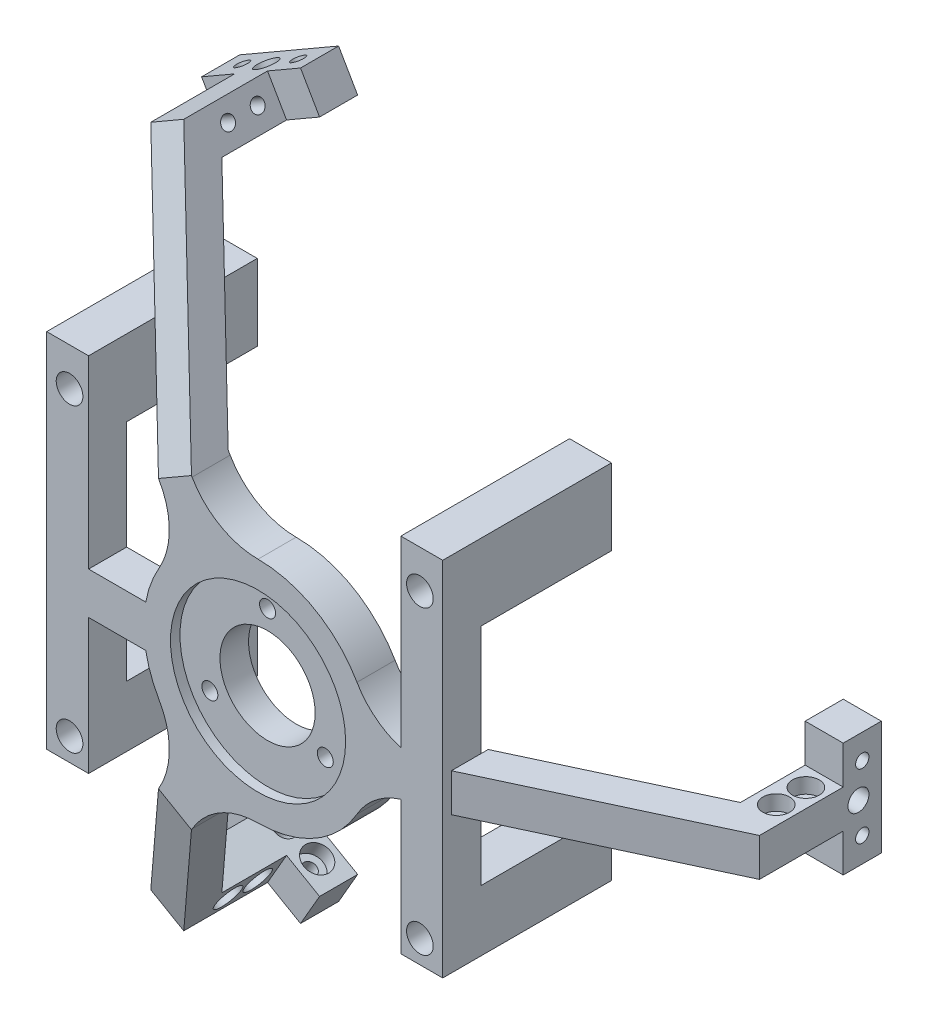
from build123d import *
from OCP.BRepFilletAPI import BRepFilletAPI_MakeChamfer

# Parameters (mm, degrees)
ESQUISSE1_W                    = 10
ESQUISSE1_H                    = 30.000000000000004
BOSS_EXTRU_1_DEPTH             = 10
BOSS_EXTRU_1_2_DEPTH           = 10
BOSS_EXTRU_1_3_DEPTH           = 10
ESQUISSE2_W                    = 10
ESQUISSE2_H                    = 9.999999999999995
BOSS_EXTRU_2_DEPTH             = 40
BOSS_EXTRU_3_DEPTH             = 10
CHANFREIN1_SIZE                = 23
CHANFREIN1_SIZE2               = 49.32365917172017
CHANFREIN2_SIZE                = 28
CHANFREIN2_SIZE2               = 60.04619377426803
CONG_1_R                       = 20
ENL_V_MAT_EXTRU_1_REACH        = 156.308
ESQUISSE4_R                    = 12.5
ESQUISSE5_R                    = 23
ENL_V_MAT_EXTRU_2_DEPTH        = 2.5
ENL_V_MAT_EXTRU_3_REACH        = 155.353
ESQUISSE6_R                    = 2.1000000000000005
ESQUISSE6_R_2                  = 2.100000000000001
BOSS_EXTRU_4_DEPTH             = 34.3
BOSS_EXTRU_4_DIRECTION_2_REACH = 152.702
ENL_V_MAT_EXTRU_4_REACH        = 150.908
ESQUISSE8_R                    = 1.7500000000000038
ESQUISSE9_R                    = 3.500000000000001
ENL_V_MAT_EXTRU_5_DEPTH        = 23.3
ENL_V_MAT_EXTRU_6_DEPTH        = 34.3
ENL_V_MAT_EXTRU_7_REACH        = 155.051
ESQUISSE11_R                   = 1.7500000000000004
ESQUISSE12_R                   = 3.5000000000000027
ESQUISSE12_R_2                 = 3.500000000000001
ENL_V_MAT_EXTRU_8_DEPTH        = 4
ENL_V_MAT_EXTRU_9_REACH        = 242.996
ESQUISSE13_R                   = 1.7499999999999998
ESQUISSE14_R                   = 3.5
ENL_V_MAT_EXTRU_10_DEPTH       = 4
ENL_V_MAT_EXTRU_11_REACH       = 242.996
ESQUISSE15_R                   = 2.75
R_P_TITION_CIRCULAIRE1_COUNT   = 3


with BuildPart() as part:
    # Esquisse1 → Boss.-Extru.1 (new body)
    with BuildSketch(Plane.XY):
        with Locations((98.67, 0)):
            Rectangle(ESQUISSE1_W, ESQUISSE1_H)
    extrude(amount=BOSS_EXTRU_1_DEPTH)



with BuildPart() as body_2:
    # Esquisse1 → Boss.-Extru.1 2 (new body)
    with BuildSketch(Plane.XY):
        Polygon((-33.84461894323341, -88.62059957248839), (-59.82538105676657, -73.6205995724884), (-64.82538105676656, -82.28085361033277), (-38.84461894323341, -97.28085361033276), align=None)
    extrude(amount=BOSS_EXTRU_1_2_DEPTH)


with BuildPart() as body_3:
    # Esquisse1 → Boss.-Extru.1 3 (new body)
    with BuildSketch(Plane.XY):
        Polygon((-59.825381056766616, 73.62059957248836), (-33.84461894323346, 88.62059957248837), (-38.84461894323348, 97.28085361033274), (-64.82538105676662, 82.28085361033273), align=None)
    extrude(amount=BOSS_EXTRU_1_3_DEPTH)


with BuildPart() as part_1:
    add(part.part)

    add(body_2.part)  # Boss.-Extru.2 merges body 2

    add(body_3.part)  # Boss.-Extru.2 merges body 3
    # Esquisse2 → Boss.-Extru.2 (add)
    with BuildSketch(Plane.XY.offset(10)):
        Polygon((-47.50487298107785, 92.28085361033274), (-56.16512701892224, 87.28085361033274), (-51.165127018922234, 78.62059957248836), (-42.50487298107785, 83.62059957248836), align=None)
        with Locations((98.67, 0)):
            Rectangle(ESQUISSE2_W, ESQUISSE2_H)
        Polygon((-42.504872981077796, -83.62059957248839), (-51.16512701892218, -78.62059957248839), (-56.16512701892218, -87.28085361033276), (-47.50487298107779, -92.28085361033277), align=None)
    extrude(amount=BOSS_EXTRU_2_DEPTH)

    # Esquisse3 → Boss.-Extru.3 (add)
    with BuildSketch(Plane.XY.offset(50)):
        with BuildLine():
            Line((103.67, 4.999999999999997), (103.67, -4.999999999999997))
            Line((103.67, -4.999999999999997), (29.58039891549808, -4.999999999999997))
            ThreePointArc((29.58039891549808, -4.999999999999997), (15.00000000000001, -25.980762113533153), (-10.460072438826828, -28.117376914899005))
            Line((-10.460072438826828, -28.117376914899005), (-47.5048729810778, -92.28085361033278))
            Line((-47.5048729810778, -92.28085361033278), (-56.16512701892218, -87.28085361033277))
            Line((-56.16512701892218, -87.28085361033277), (-19.120326476671217, -23.11737691489902))
            ThreePointArc((-19.120326476671217, -23.11737691489902), (-30.000000000000007, -3.032e-14), (-19.12032647667126, 23.117376914898983))
            Line((-19.12032647667126, 23.117376914898983), (-56.16512701892224, 87.28085361033274))
            Line((-56.16512701892224, 87.28085361033274), (-47.504872981077845, 92.28085361033276))
            Line((-47.504872981077845, 92.28085361033276), (-10.46007243882688, 28.117376914898994))
            ThreePointArc((-10.46007243882688, 28.117376914898994), (14.999999999999991, 25.980762113533178), (29.580398915498087, 4.999999999999997))
            Line((29.580398915498087, 4.999999999999997), (103.67, 4.999999999999997))
        make_face()
    extrude(amount=BOSS_EXTRU_3_DEPTH)

    # Chanfrein1: one chamfer whose edges measure the first distance from different faces: ONE call of the kernel's chamfer builder (chamfer() names one face for all edges)
    chanfrein1_edges_1 = [part_1.edges().sort_by_distance(p)[0] for p in [
        (93.67, 0, 50),
    ]]
    chanfrein1_side_1 = [part_1.faces().sort_by_distance(p)[0] for p in [
        (93.67000000000002, -7.9e-16, 19.28571428571428),
    ]]
    chanfrein1_edges_2 = [part_1.edges().sort_by_distance(p)[0] for p in [
        (-46.83499999999999, -81.12059957248839, 50),
    ]]
    chanfrein1_side_2 = [part_1.faces().sort_by_distance(p)[0] for p in [
        (-46.834999999999994, -81.12059957248839, 19.285714285714285),
    ]]
    chanfrein1_edges_3 = [part_1.edges().sort_by_distance(p)[0] for p in [
        (-46.83500000000004, 81.12059957248836, 50),
    ]]
    chanfrein1_side_3 = [part_1.faces().sort_by_distance(p)[0] for p in [
        (-46.835000000000036, 81.12059957248836, 19.285714285714285),
    ]]
    chanfrein1 = BRepFilletAPI_MakeChamfer(part_1.part.solid().wrapped)
    for e in chanfrein1_edges_1:
        chanfrein1.Add(CHANFREIN1_SIZE, CHANFREIN1_SIZE2, e.wrapped, chanfrein1_side_1[0].wrapped)  # the first distance lies on this face
    for e in chanfrein1_edges_2:
        chanfrein1.Add(CHANFREIN1_SIZE, CHANFREIN1_SIZE2, e.wrapped, chanfrein1_side_2[0].wrapped)  # the first distance lies on this face
    for e in chanfrein1_edges_3:
        chanfrein1.Add(CHANFREIN1_SIZE, CHANFREIN1_SIZE2, e.wrapped, chanfrein1_side_3[0].wrapped)  # the first distance lies on this face
    add(Compound.cast(chanfrein1.Shape()), mode=Mode.REPLACE)

    # Chanfrein2: one chamfer whose edges measure the first distance from different faces: ONE call of the kernel's chamfer builder (chamfer() names one face for all edges)
    chanfrein2_edges_1 = [part_1.edges().sort_by_distance(p)[0] for p in [
        (-51.83500000000004, 89.78085361033276, 60),
    ]]
    chanfrein2_side_1 = [part_1.faces().sort_by_distance(p)[0] for p in [
        (-51.83500000000004, 89.78085361033273, 23.75000000000001),
    ]]
    chanfrein2_edges_2 = [part_1.edges().sort_by_distance(p)[0] for p in [
        (-51.834999999999994, -89.78085361033278, 60),
    ]]
    chanfrein2_side_2 = [part_1.faces().sort_by_distance(p)[0] for p in [
        (-51.834999999999994, -89.78085361033278, 23.750000000000004),
    ]]
    chanfrein2_edges_3 = [part_1.edges().sort_by_distance(p)[0] for p in [
        (103.67, 0, 60),
    ]]
    chanfrein2_side_3 = [part_1.faces().sort_by_distance(p)[0] for p in [
        (103.67, 2e-17, 23.75),
    ]]
    chanfrein2 = BRepFilletAPI_MakeChamfer(part_1.part.solid().wrapped)
    for e in chanfrein2_edges_1:
        chanfrein2.Add(CHANFREIN2_SIZE, CHANFREIN2_SIZE2, e.wrapped, chanfrein2_side_1[0].wrapped)  # the first distance lies on this face
    for e in chanfrein2_edges_2:
        chanfrein2.Add(CHANFREIN2_SIZE, CHANFREIN2_SIZE2, e.wrapped, chanfrein2_side_2[0].wrapped)  # the first distance lies on this face
    for e in chanfrein2_edges_3:
        chanfrein2.Add(CHANFREIN2_SIZE, CHANFREIN2_SIZE2, e.wrapped, chanfrein2_side_3[0].wrapped)  # the first distance lies on this face
    add(Compound.cast(chanfrein2.Shape()), mode=Mode.REPLACE)

    # Congé1
    cong_1_edges = [part_1.edges().sort_by_distance(p)[0] for p in [
        (29.580398915498087, 4.999999999999999, 55),
        (-10.46007243882688, 28.117376914898994, 55),
        (-19.12032647667126, 23.117376914898983, 55),
        (-19.120326476671217, -23.11737691489902, 55),
        (-10.460072438826828, -28.117376914899005, 55),
        (29.58039891549808, -4.999999999999997, 55),
    ]]
    fillet(cong_1_edges, radius=CONG_1_R)

    # Esquisse4 → Enlèv. mat.-Extru.1 (cut, up to next)
    with BuildSketch(Plane.XY.offset(60.00000000000001), mode=Mode.PRIVATE) as enl_v_mat_extru_1_sk1:
        Circle(ESQUISSE4_R)
    enl_v_mat_extru_1_tool1 = extrude(enl_v_mat_extru_1_sk1.sketch, amount=-ENL_V_MAT_EXTRU_1_REACH, mode=Mode.PRIVATE) & part_1.part
    add(enl_v_mat_extru_1_tool1.solids().sort_by_distance((0, 0, 60))[0], mode=Mode.SUBTRACT)

    # Esquisse5 → Enlèv. mat.-Extru.2 (cut)
    with BuildSketch(Plane.XY.offset(60.00000000000001)):
        Circle(ESQUISSE5_R)
    extrude(amount=-ENL_V_MAT_EXTRU_2_DEPTH, mode=Mode.SUBTRACT)

    # Esquisse6 → Enlèv. mat.-Extru.3 (cut, up to next)
    with BuildSketch(Plane.XY.offset(57.5), mode=Mode.PRIVATE) as enl_v_mat_extru_3_sk1:
        with Locations((1.6e-16, 17.5)):
            Circle(ESQUISSE6_R)
    enl_v_mat_extru_3_tool1 = extrude(enl_v_mat_extru_3_sk1.sketch, amount=-ENL_V_MAT_EXTRU_3_REACH, mode=Mode.PRIVATE) & part_1.part
    # Esquisse6 → Enlèv. mat.-Extru.3 (cut, up to next)
    with BuildSketch(Plane.XY.offset(57.5), mode=Mode.PRIVATE) as enl_v_mat_extru_3_sk2:
        with Locations((15.155444566227679, -8.749999999999998)):
            Circle(ESQUISSE6_R_2)
    enl_v_mat_extru_3_tool2 = extrude(enl_v_mat_extru_3_sk2.sketch, amount=-ENL_V_MAT_EXTRU_3_REACH, mode=Mode.PRIVATE) & part_1.part
    # Esquisse6 → Enlèv. mat.-Extru.3 (cut, up to next)
    with BuildSketch(Plane.XY.offset(57.5), mode=Mode.PRIVATE) as enl_v_mat_extru_3_sk3:
        with Locations((-15.155444566227676, -8.750000000000007)):
            Circle(ESQUISSE6_R_2)
    enl_v_mat_extru_3_tool3 = extrude(enl_v_mat_extru_3_sk3.sketch, amount=-ENL_V_MAT_EXTRU_3_REACH, mode=Mode.PRIVATE) & part_1.part
    add(enl_v_mat_extru_3_tool1.solids().sort_by_distance((0, 17.5, 57.5))[0], mode=Mode.SUBTRACT)
    add(enl_v_mat_extru_3_tool2.solids().sort_by_distance((15.155445, -8.75, 57.5))[0], mode=Mode.SUBTRACT)
    add(enl_v_mat_extru_3_tool3.solids().sort_by_distance((-15.155445, -8.75, 57.5))[0], mode=Mode.SUBTRACT)

    # Esquisse7 → Boss.-Extru.4 (add)
    with BuildSketch(Plane(origin=(0, 0, 50), x_dir=(-1, 0, 0), z_dir=(0, 0, -1))):
        Polygon((-37.49999999999999, -41.00000000000001), (-48.499999999999986, -41.00000000000001), (-48.49999999999998, 53.99999999999999), (-37.50000000000003, 53.99999999999999), align=None)
        with BuildLine():
            Line((55.49999999999999, -40.99999999999999), (44.5, -40.99999999999999))
            Line((44.5, -40.99999999999999), (44.5, -5.499999999999998))
            Line((44.5, -5.499999999999998), (29.491524206117262, -5.5))
            ThreePointArc((29.491524206117262, -5.5), (30.000000000000007, -2.5e-15), (29.49152420611726, 5.499999999999995))
            Line((29.49152420611726, 5.499999999999995), (44.5, 5.499999999999998))
            Line((44.5, 5.499999999999998), (44.500000000000014, 54.00000000000001))
            Line((44.500000000000014, 54.00000000000001), (55.49999999999998, 54.00000000000001))
            Line((55.49999999999998, 54.00000000000001), (55.49999999999999, -40.99999999999999))
        make_face()
    extrude(amount=BOSS_EXTRU_4_DEPTH)

    # Boss.-Extru.4 direction 2: up to this face of the body (flat: up to its plane)
    boss_extru_4_direction_2_end = Plane(part_1.part.faces().sort_by_distance((43.462538207, 3.908663171, 60))[0])
    # Esquisse7 → Boss.-Extru.4 direction 2 (add, up to the picked face)
    with BuildSketch(Plane(origin=(0, 0, 50), x_dir=(-1, 0, 0), z_dir=(0, 0, -1)), mode=Mode.PRIVATE) as boss_extru_4_direction_2_sk1:
        Polygon((-37.49999999999999, -41.00000000000001), (-48.499999999999986, -41.00000000000001), (-48.49999999999998, 53.99999999999999), (-37.50000000000003, 53.99999999999999), align=None)
    boss_extru_4_direction_2_tool1 = split(extrude(boss_extru_4_direction_2_sk1.sketch, amount=-BOSS_EXTRU_4_DIRECTION_2_REACH, mode=Mode.PRIVATE), bisect_by=boss_extru_4_direction_2_end, keep=Keep.BOTH, mode=Mode.PRIVATE)
    # Esquisse7 → Boss.-Extru.4 direction 2 (add, up to the picked face)
    with BuildSketch(Plane(origin=(0, 0, 50), x_dir=(-1, 0, 0), z_dir=(0, 0, -1)), mode=Mode.PRIVATE) as boss_extru_4_direction_2_sk2:
        with BuildLine():
            Line((55.49999999999999, -40.99999999999999), (44.5, -40.99999999999999))
            Line((44.5, -40.99999999999999), (44.5, -5.499999999999998))
            Line((44.5, -5.499999999999998), (29.491524206117262, -5.5))
            ThreePointArc((29.491524206117262, -5.5), (30.000000000000007, -2.5e-15), (29.49152420611726, 5.499999999999995))
            Line((29.49152420611726, 5.499999999999995), (44.5, 5.499999999999998))
            Line((44.5, 5.499999999999998), (44.500000000000014, 54.00000000000001))
            Line((44.500000000000014, 54.00000000000001), (55.49999999999998, 54.00000000000001))
            Line((55.49999999999998, 54.00000000000001), (55.49999999999999, -40.99999999999999))
        make_face()
    boss_extru_4_direction_2_tool2 = split(extrude(boss_extru_4_direction_2_sk2.sketch, amount=-BOSS_EXTRU_4_DIRECTION_2_REACH, mode=Mode.PRIVATE), bisect_by=boss_extru_4_direction_2_end, keep=Keep.BOTH, mode=Mode.PRIVATE)
    add(boss_extru_4_direction_2_tool1.solids().sort_by(Axis((43, 6.5, 50), (0, 0, 1)))[0])
    add(boss_extru_4_direction_2_tool2.solids().sort_by(Axis((-48.283205, 5.630584, 50), (0, 0, 1)))[0])

    # Esquisse8 → Enlèv. mat.-Extru.4 (cut, up to next)
    with BuildSketch(Plane(origin=(0, 0, 15.700000000000006), x_dir=(-1, 0, 0), z_dir=(0, 0, -1)), mode=Mode.PRIVATE) as enl_v_mat_extru_4_sk1:
        with Locations((49.499999999999986, 44.00000000000001)):
            Circle(ESQUISSE8_R)
    enl_v_mat_extru_4_tool1 = extrude(enl_v_mat_extru_4_sk1.sketch, amount=-ENL_V_MAT_EXTRU_4_REACH, mode=Mode.PRIVATE) & part_1.part
    # Esquisse8 → Enlèv. mat.-Extru.4 (cut, up to next)
    with BuildSketch(Plane(origin=(0, 0, 15.700000000000006), x_dir=(-1, 0, 0), z_dir=(0, 0, -1)), mode=Mode.PRIVATE) as enl_v_mat_extru_4_sk2:
        with Locations((-42.50000000000001, 43.99999999999999)):
            Circle(ESQUISSE8_R)
    enl_v_mat_extru_4_tool2 = extrude(enl_v_mat_extru_4_sk2.sketch, amount=-ENL_V_MAT_EXTRU_4_REACH, mode=Mode.PRIVATE) & part_1.part
    # Esquisse8 → Enlèv. mat.-Extru.4 (cut, up to next)
    with BuildSketch(Plane(origin=(0, 0, 15.700000000000006), x_dir=(-1, 0, 0), z_dir=(0, 0, -1)), mode=Mode.PRIVATE) as enl_v_mat_extru_4_sk3:
        with Locations((-42.50000000000001, -35.00000000000001)):
            Circle(ESQUISSE8_R)
    enl_v_mat_extru_4_tool3 = extrude(enl_v_mat_extru_4_sk3.sketch, amount=-ENL_V_MAT_EXTRU_4_REACH, mode=Mode.PRIVATE) & part_1.part
    # Esquisse8 → Enlèv. mat.-Extru.4 (cut, up to next)
    with BuildSketch(Plane(origin=(0, 0, 15.700000000000006), x_dir=(-1, 0, 0), z_dir=(0, 0, -1)), mode=Mode.PRIVATE) as enl_v_mat_extru_4_sk4:
        with Locations((49.500000000000014, -34.99999999999999)):
            Circle(ESQUISSE8_R)
    enl_v_mat_extru_4_tool4 = extrude(enl_v_mat_extru_4_sk4.sketch, amount=-ENL_V_MAT_EXTRU_4_REACH, mode=Mode.PRIVATE) & part_1.part
    add(enl_v_mat_extru_4_tool1.solids().sort_by_distance((-49.5, 44, 15.7))[0], mode=Mode.SUBTRACT)
    add(enl_v_mat_extru_4_tool2.solids().sort_by_distance((42.5, 44, 15.7))[0], mode=Mode.SUBTRACT)
    add(enl_v_mat_extru_4_tool3.solids().sort_by_distance((42.5, -35, 15.7))[0], mode=Mode.SUBTRACT)
    add(enl_v_mat_extru_4_tool4.solids().sort_by_distance((-49.5, -35, 15.7))[0], mode=Mode.SUBTRACT)

    # Esquisse9 → Enlèv. mat.-Extru.5 (cut)
    with BuildSketch(Plane.XY.offset(60.00000000000001)):
        with Locations((42.50000000000001, -35.00000000000001)):
            Circle(ESQUISSE9_R)
        with Locations((42.50000000000001, 43.99999999999999)):
            Circle(ESQUISSE9_R)
        with Locations((-49.500000000000014, -34.99999999999999)):
            Circle(ESQUISSE9_R)
        with Locations((-49.499999999999986, 44.00000000000001)):
            Circle(ESQUISSE9_R)
    extrude(amount=-ENL_V_MAT_EXTRU_5_DEPTH, mode=Mode.SUBTRACT)

    # Esquisse10 → Enlèv. mat.-Extru.6 (cut)
    with BuildSketch(Plane(origin=(0, 0, 15.700000000000006), x_dir=(-1, 0, 0), z_dir=(0, 0, -1))):
        Polygon((-48.49999999999998, 34), (55.49999999999999, 34), (55.49999999999999, -24.999999999999993), (-48.49999999999997, -24.999999999999993), align=None)
    extrude(amount=-ENL_V_MAT_EXTRU_6_DEPTH, mode=Mode.SUBTRACT)

    # Esquisse11 → Enlèv. mat.-Extru.7 (cut, up to next)
    with BuildSketch(Plane(origin=(4.330127018922215, -2.500000000000013, 0), x_dir=(0, 0, -1), z_dir=(0.8660254037844387, -0.49999999999999994, 0)), mode=Mode.PRIVATE) as enl_v_mat_extru_7_sk1:
        with Locations(Location((-15, -98.86, 0), (0, 0, 90))):
            Circle(ESQUISSE11_R)
    enl_v_mat_extru_7_tool1 = extrude(enl_v_mat_extru_7_sk1.sketch, amount=-ENL_V_MAT_EXTRU_7_REACH, mode=Mode.PRIVATE) & part_1.part
    # Esquisse11 → Enlèv. mat.-Extru.7 (cut, up to next)
    with BuildSketch(Plane(origin=(4.330127018922215, -2.500000000000013, 0), x_dir=(0, 0, -1), z_dir=(0.8660254037844387, -0.49999999999999994, 0)), mode=Mode.PRIVATE) as enl_v_mat_extru_7_sk2:
        with Locations(Location((-22.78, -98.86, 0), (0, 0, 90))):
            Circle(ESQUISSE11_R)
    enl_v_mat_extru_7_tool2 = extrude(enl_v_mat_extru_7_sk2.sketch, amount=-ENL_V_MAT_EXTRU_7_REACH, mode=Mode.PRIVATE) & part_1.part
    enl_v_mat_extru_7_1 = enl_v_mat_extru_7_tool1.solids().sort_by_distance((-45.099873, -88.115271, 15))[0]
    add(enl_v_mat_extru_7_1, mode=Mode.SUBTRACT)
    enl_v_mat_extru_7_2 = enl_v_mat_extru_7_tool2.solids().sort_by_distance((-45.099873, -88.115271, 22.78))[0]
    add(enl_v_mat_extru_7_2, mode=Mode.SUBTRACT)
    enl_v_mat_extru_7 = enl_v_mat_extru_7_1 + enl_v_mat_extru_7_2  # Enlèv. mat.-Extru.7 as one shape, for the pattern or mirror that repeats it

    # Esquisse12 → Enlèv. mat.-Extru.8 (cut)
    with BuildSketch(Plane(origin=(4.330127018922215, -2.500000000000013, 0), x_dir=(0, 0, -1), z_dir=(0.8660254037844387, -0.49999999999999994, 0))):
        with Locations(Location((-15, -98.85999999999999, 0), (0, 0, 90))):
            Circle(ESQUISSE12_R)
        with Locations(Location((-22.78, -98.85999999999999, 0), (0, 0, 90))):
            Circle(ESQUISSE12_R_2)
    enl_v_mat_extru_8 = extrude(amount=-ENL_V_MAT_EXTRU_8_DEPTH, mode=Mode.SUBTRACT)

    # Esquisse13 → Enlèv. mat.-Extru.9 (cut, up to next)
    with BuildSketch(Plane(origin=(-46.83499999999999, -81.12059957248842, 0), x_dir=(0.8660254037844389, -0.49999999999999967, 0), z_dir=(0.49999999999999967, 0.8660254037844389, 0)), mode=Mode.PRIVATE) as enl_v_mat_extru_9_sk1:
        with Locations(Location((-8.500000000000021, -5.000000000000001, 0), (0, 0, 180))):
            Circle(ESQUISSE13_R)
    enl_v_mat_extru_9_tool1 = extrude(enl_v_mat_extru_9_sk1.sketch, amount=-ENL_V_MAT_EXTRU_9_REACH, mode=Mode.PRIVATE) & part_1.part
    # Esquisse13 → Enlèv. mat.-Extru.9 (cut, up to next)
    with BuildSketch(Plane(origin=(-46.83499999999999, -81.12059957248842, 0), x_dir=(0.8660254037844389, -0.49999999999999967, 0), z_dir=(0.49999999999999967, 0.8660254037844389, 0)), mode=Mode.PRIVATE) as enl_v_mat_extru_9_sk2:
        with Locations(Location((8.499999999999977, -5, 0), (0, 0, 180))):
            Circle(ESQUISSE13_R)
    enl_v_mat_extru_9_tool2 = extrude(enl_v_mat_extru_9_sk2.sketch, amount=-ENL_V_MAT_EXTRU_9_REACH, mode=Mode.PRIVATE) & part_1.part
    enl_v_mat_extru_9_1 = enl_v_mat_extru_9_tool1.solids().sort_by_distance((-54.196216, -76.8706, 5))[0]
    add(enl_v_mat_extru_9_1, mode=Mode.SUBTRACT)
    enl_v_mat_extru_9_2 = enl_v_mat_extru_9_tool2.solids().sort_by_distance((-39.473784, -85.3706, 5))[0]
    add(enl_v_mat_extru_9_2, mode=Mode.SUBTRACT)
    enl_v_mat_extru_9 = enl_v_mat_extru_9_1 + enl_v_mat_extru_9_2  # Enlèv. mat.-Extru.9 as one shape, for the pattern or mirror that repeats it

    # Esquisse14 → Enlèv. mat.-Extru.10 (cut)
    with BuildSketch(Plane(origin=(-46.83499999999999, -81.12059957248842, 0), x_dir=(0.8660254037844389, -0.49999999999999967, 0), z_dir=(0.49999999999999967, 0.8660254037844389, 0))):
        with Locations(Location((-8.500000000000021, -5.000000000000001, 0), (0, 0, 180))):
            Circle(ESQUISSE14_R)
        with Locations(Location((8.499999999999977, -5, 0), (0, 0, 180))):
            Circle(ESQUISSE14_R)
    enl_v_mat_extru_10 = extrude(amount=-ENL_V_MAT_EXTRU_10_DEPTH, mode=Mode.SUBTRACT)

    # Esquisse15 → Enlèv. mat.-Extru.11 (cut, up to next)
    with BuildSketch(Plane(origin=(-46.83499999999999, -81.12059957248842, 0), x_dir=(0.8660254037844389, -0.49999999999999967, 0), z_dir=(0.49999999999999967, 0.8660254037844389, 0)), mode=Mode.PRIVATE) as enl_v_mat_extru_11_sk1:
        with Locations(Location((0, -6, 0), (0, 0, 180))):
            Circle(ESQUISSE15_R)
    enl_v_mat_extru_11_tool1 = extrude(enl_v_mat_extru_11_sk1.sketch, amount=-ENL_V_MAT_EXTRU_11_REACH, mode=Mode.PRIVATE) & part_1.part
    enl_v_mat_extru_11 = enl_v_mat_extru_11_tool1.solids().sort_by_distance((-46.835, -81.1206, 6))[0]
    add(enl_v_mat_extru_11, mode=Mode.SUBTRACT)

    # Répétition circulaire1: Enlèv. mat.-Extru.7, Enlèv. mat.-Extru.8, Enlèv. mat.-Extru.9, Enlèv. mat.-Extru.10, Enlèv. mat.-Extru.11 ×3 about axis
    r_p_tition_circulaire1_axis = Axis((-6.52e-15, 1.237e-14, 0), (0, 0, 1))
    add([enl_v_mat_extru_7.rotate(r_p_tition_circulaire1_axis, i * 360 / R_P_TITION_CIRCULAIRE1_COUNT) for i in range(1, R_P_TITION_CIRCULAIRE1_COUNT)], mode=Mode.SUBTRACT)
    add([enl_v_mat_extru_8.rotate(r_p_tition_circulaire1_axis, i * 360 / R_P_TITION_CIRCULAIRE1_COUNT) for i in range(1, R_P_TITION_CIRCULAIRE1_COUNT)], mode=Mode.SUBTRACT)
    add([enl_v_mat_extru_9.rotate(r_p_tition_circulaire1_axis, i * 360 / R_P_TITION_CIRCULAIRE1_COUNT) for i in range(1, R_P_TITION_CIRCULAIRE1_COUNT)], mode=Mode.SUBTRACT)
    add([enl_v_mat_extru_10.rotate(r_p_tition_circulaire1_axis, i * 360 / R_P_TITION_CIRCULAIRE1_COUNT) for i in range(1, R_P_TITION_CIRCULAIRE1_COUNT)], mode=Mode.SUBTRACT)
    add([enl_v_mat_extru_11.rotate(r_p_tition_circulaire1_axis, i * 360 / R_P_TITION_CIRCULAIRE1_COUNT) for i in range(1, R_P_TITION_CIRCULAIRE1_COUNT)], mode=Mode.SUBTRACT)


solid = part_1.part
